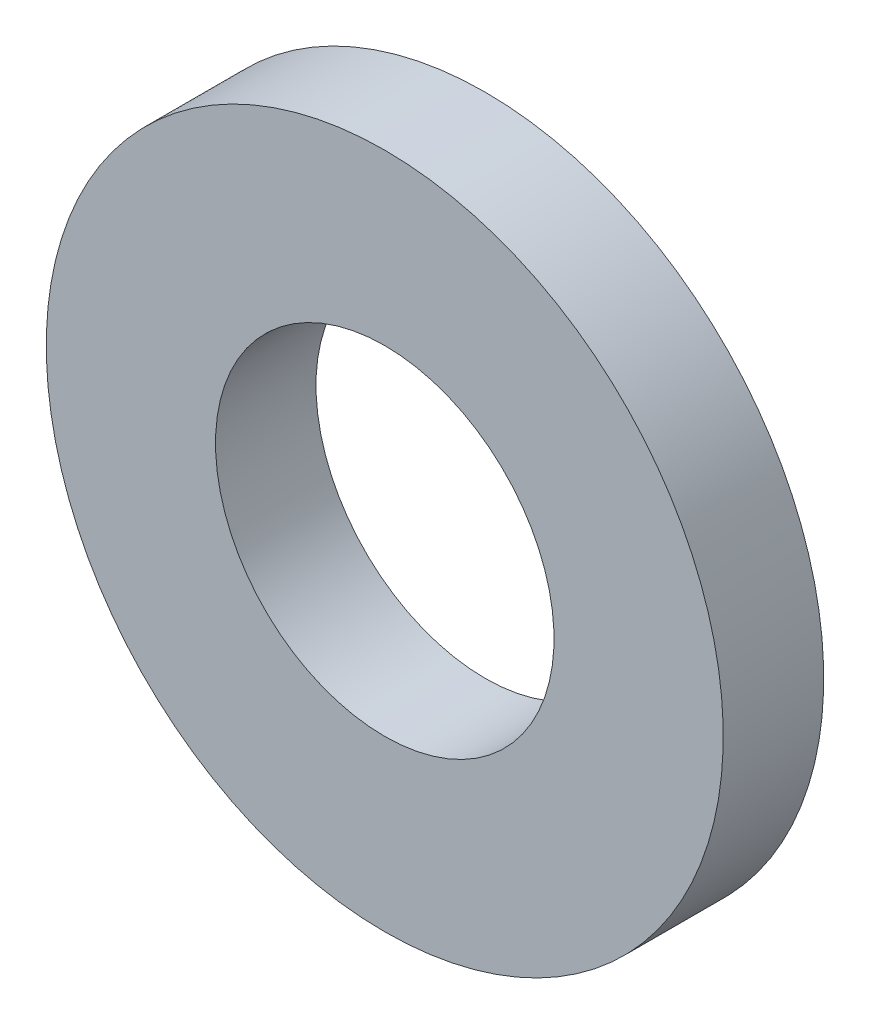
from build123d import *

# Parameters (mm, degrees)
SKETCH2_W = 1.651
SKETCH2_H = 2.7813


with BuildPart() as part:
    # Sketch2 → Revolve1 (revolve)
    with BuildSketch(Plane(origin=(0, 0, 0), x_dir=(0, 0, -1), z_dir=(1, 0, 0))):
        with Locations((-0.8255, 4.17195)):
            Rectangle(SKETCH2_W, SKETCH2_H)
    revolve(axis=Axis((0, 0, 1.651), (0, 0, 1)))


solid = part.part
